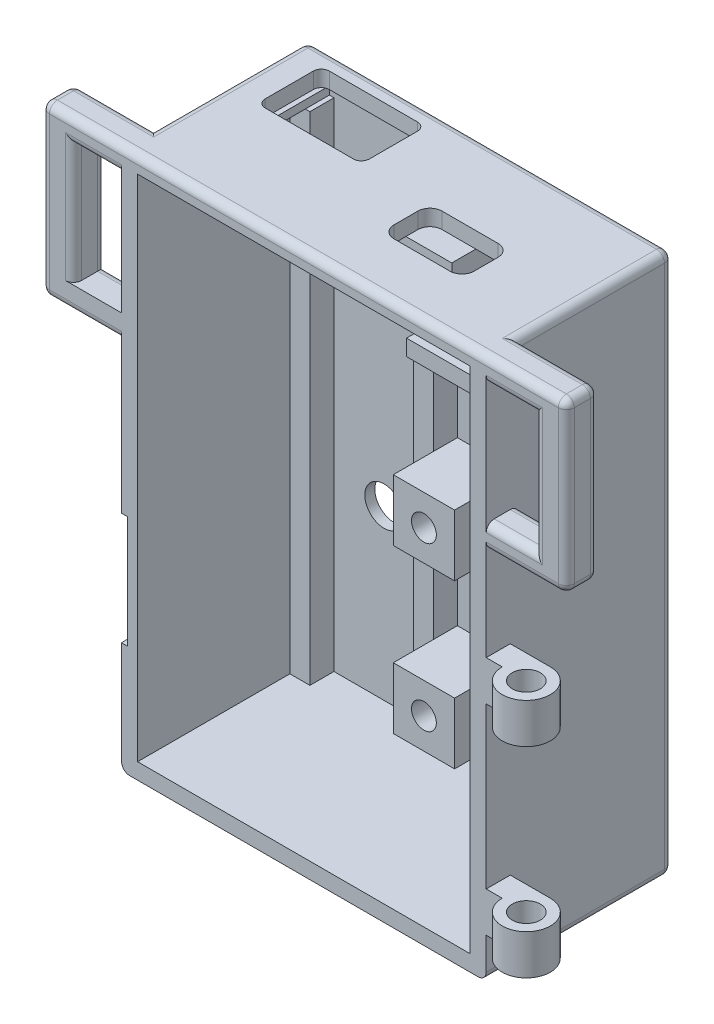
from build123d import *

# Parameters (mm, degrees)
SKETCH1_W                 = 45.5
SKETCH1_H                 = 67.5
BOSS_EXTRUDE1_DEPTH       = 1.25
SKETCH21_W                = 1.925
SKETCH21_H                = 1
BOSS_EXTRUDE10_DEPTH      = 8
SKETCH7_W                 = 45.5
SKETCH7_H                 = 67.5
SKETCH7_W_2               = 41.5
SKETCH7_H_2               = 63.5
BOSS_EXTRUDE4_DEPTH       = 22
SKETCH18_W                = 13
SKETCH18_H                = 8
CUT_EXTRUDE10_DEPTH       = 2
BOSS_EXTRUDE20_DEPTH      = 4
SKETCH49_R                = 1.75
BOSS_EXTRUDE21_DEPTH      = 35
SKETCH50_W                = 13.462095761
SKETCH50_H                = 5
SKETCH50_W_2              = 20.764616991
SKETCH50_H_2              = 20
CUT_EXTRUDE12_DEPTH       = 12
FILLET7_R                 = 1
M4_CLEARANCE_HOLE1_D      = 4.8
SKETCH42_W                = 7.3
SKETCH42_H                = 7.3
SKETCH42_W_2              = 19.24
SKETCH42_H_2              = 2
SKETCH42_W_3              = 7.65
SKETCH42_H_3              = 7.65
BOSS_EXTRUDE19_DEPTH      = 8
F_3_0MM_DOWEL_HOLE1_D     = 3.1
F_3_0MM_DOWEL_HOLE1_DEPTH = 2.8
F_3_0MM_DOWEL_HOLE1_TIP   = 0.931333959
SKETCH52_W                = 10
SKETCH52_H                = 6
CUT_EXTRUDE13_DEPTH       = 12
FILLET11_R                = 1.5
FILLET13_R                = 1
FILLET15_R                = 1
FILLET14_R                = 1
SKETCH53_R                = 7
CUT_EXTRUDE14_DEPTH       = 0.75
SKETCH54_W                = 2.5
SKETCH54_H                = 62
BOSS_EXTRUDE22_DEPTH      = 3


with BuildPart() as part:
    # Sketch1 → Boss-Extrude1 (new body)
    with BuildSketch(Plane.XY):
        Rectangle(SKETCH1_W, SKETCH1_H)
    extrude(amount=BOSS_EXTRUDE1_DEPTH)

    # Sketch21 → Boss-Extrude10 (add)
    with BuildSketch(Plane.XY.offset(1.25)):
        with Locations((-19.7875, 30.75)):
            Rectangle(SKETCH21_W, SKETCH21_H)
        with Locations((-3.8125, 30.75)):
            Rectangle(SKETCH21_W, SKETCH21_H)
    extrude(amount=BOSS_EXTRUDE10_DEPTH)

    # Sketch7 → Boss-Extrude4 (add)
    with BuildSketch(Plane.XY.offset(1.25)):
        Rectangle(SKETCH7_W, SKETCH7_H)
        Rectangle(SKETCH7_W_2, SKETCH7_H_2, mode=Mode.SUBTRACT)
    extrude(amount=BOSS_EXTRUDE4_DEPTH)

    # Sketch18 → Cut-Extrude10 (cut)
    with BuildSketch(Plane(origin=(0, 33.75, 0), x_dir=(1, 0, 0), z_dir=(0, 1, 0))):
        with Locations((-12.425, -6.15)):
            Rectangle(SKETCH18_W, SKETCH18_H)
    extrude(amount=-CUT_EXTRUDE10_DEPTH, mode=Mode.SUBTRACT)

    # Sketch48 → Boss-Extrude20 (add)
    with BuildSketch(Plane.XY.offset(23.25)):
        Polygon((22.75, 33.75), (32.75, 33.75), (32.75, 12.75), (22.75, 12.75), (22.75, 15.75), (28.75, 15.75), (28.75, 30.75), (22.75, 30.75), align=None)
        Polygon((-22.75, 30.75), (-28.75, 30.75), (-28.75, 15.75), (-22.75, 15.75), (-22.75, 12.75), (-32.75, 12.75), (-32.75, 33.75), (-22.75, 33.75), align=None)
    extrude(amount=-BOSS_EXTRUDE20_DEPTH)

    # Sketch49 → Boss-Extrude21 (add)
    with BuildSketch(Plane.XZ.offset(33.75)):
        with BuildLine():
            Line((27.75, 20.25), (22.75, 20.25))
            Line((22.75, 20.25), (22.75, 23.25))
            Line((22.75, 23.25), (24.75, 23.25))
            ThreePointArc((24.75, 23.25), (29.871320344, 25.371320344), (27.75, 20.25))
        make_face()
        with Locations(Location((27.75, 23.25, 0), (0, 0, 270))):
            Circle(SKETCH49_R, mode=Mode.SUBTRACT)
    extrude(amount=-BOSS_EXTRUDE21_DEPTH)

    # Sketch50 → Cut-Extrude12 (cut)
    with BuildSketch(Plane(origin=(22.75, 0, 0), x_dir=(0, 0, -1), z_dir=(1, 0, 0))):
        with Locations((-22.765361812, -31.25)):
            Rectangle(SKETCH50_W, SKETCH50_H)
        with Locations((-19.114101197, -13.75)):
            Rectangle(SKETCH50_W_2, SKETCH50_H_2)
    extrude(amount=CUT_EXTRUDE12_DEPTH, mode=Mode.SUBTRACT)

    # Fillet7
    fillet7_edges = [part.edges().sort_by_distance(p)[0] for p in [
        (-18.925, 32.75, 2.15),
        (-18.925, 32.75, 10.15),
        (-5.925, 32.75, 10.15),
        (-5.925, 32.75, 2.15),
    ]]
    fillet(fillet7_edges, radius=FILLET7_R)

    # M4 Clearance Hole1 (through all)
    with Locations(Plane.XY.offset(1.25)):
        with Locations((-12, 24.25), (8, 24.25), (8, -10.75), (-12, -10.75)):
            Hole(M4_CLEARANCE_HOLE1_D / 2)

    # Sketch42 → Boss-Extrude19 (add)
    with BuildSketch(Plane.XY.offset(1.25)):
        with Locations((0.8, 24.1)):
            Rectangle(SKETCH42_W, SKETCH42_H)
        with Locations((16.04, 24.1)):
            Rectangle(SKETCH42_W, SKETCH42_H)
        with Locations((8.42, 15.806169598)):
            Rectangle(SKETCH42_W_2, SKETCH42_H_2)
        with Locations((0.975, -22.925)):
            Rectangle(SKETCH42_W_3, SKETCH42_H_3)
        with Locations((13.675, -22.925)):
            Rectangle(SKETCH42_W_3, SKETCH42_H_3)
        with Locations((13.675, -2.605)):
            Rectangle(SKETCH42_W_3, SKETCH42_H_3)
        with Locations((0.975, -2.605)):
            Rectangle(SKETCH42_W_3, SKETCH42_H_3)
    extrude(amount=BOSS_EXTRUDE19_DEPTH)

    # Ø3.0mm Dowel Hole1
    with Locations(Plane.XY.offset(9.25)):
        with Locations((0.8, 24.1), (16.04, 24.1), (13.675, -2.605), (0.975, -2.605), (0.975, -22.925), (13.675, -22.925)):
            Hole(F_3_0MM_DOWEL_HOLE1_D / 2, depth=F_3_0MM_DOWEL_HOLE1_DEPTH)
            with Locations((0, 0, -(F_3_0MM_DOWEL_HOLE1_DEPTH + F_3_0MM_DOWEL_HOLE1_TIP / 2))):  # 118° drill point
                Cone(0, F_3_0MM_DOWEL_HOLE1_D / 2, F_3_0MM_DOWEL_HOLE1_TIP, mode=Mode.SUBTRACT)

    # Sketch52 → Cut-Extrude13 (cut)
    with BuildSketch(Plane(origin=(0, 31.75, 0), x_dir=(-1, 0, 0), z_dir=(0, -1, 0))):
        with Locations((-7.73, -13.25)):
            Rectangle(SKETCH52_W, SKETCH52_H)
    extrude(amount=-CUT_EXTRUDE13_DEPTH, mode=Mode.SUBTRACT)

    # Fillet11
    fillet11_edges = [part.edges().sort_by_distance(p)[0] for p in [
        (2.73, 32.75, 10.25),
        (2.73, 32.75, 16.25),
        (12.73, 32.75, 16.25),
        (12.73, 32.75, 10.25),
    ]]
    fillet(fillet11_edges, radius=FILLET11_R)

    # Fillet13
    fillet13_edges = [part.edges().sort_by_distance(p)[0] for p in [
        (22.75, -33.75, 11.625),
        (0, 33.75, 0),
        (22.75, 0, 0),
        (0, -33.75, 0),
        (-22.75, 0, 0),
        (-22.75, -33.75, 11.625),
        (-22.75, 33.75, 9.625),
        (22.75, 33.75, 9.625),
    ]]
    fillet(fillet13_edges, radius=FILLET13_R)

    # Fillet15
    fillet15_edges = [part.edges().sort_by_distance(p)[0] for p in [
        (25.75, 30.75, 23.25),
        (28.75, 23.25, 23.25),
        (32.75, 23.25, 23.25),
        (25.75, 15.75, 23.25),
        (27.75, 12.75, 23.25),
        (32.75, 12.75, 21.25),
        (32.75, 33.75, 21.25),
        (27.25, 33.75, 19.25),
        (25.75, 30.75, 19.25),
        (28.75, 23.25, 19.25),
        (32.75, 23.25, 19.25),
        (27.75, 12.75, 19.25),
        (25.75, 15.75, 19.25),
        (0, 33.75, 23.25),
    ]]
    fillet(fillet15_edges, radius=FILLET15_R)

    # Fillet14
    fillet14_edges = [part.edges().sort_by_distance(p)[0] for p in [
        (-25.75, 30.75, 19.25),
        (-28.75, 23.25, 19.25),
        (-25.75, 15.75, 19.25),
        (-27.75, 12.75, 19.25),
        (-32.75, 23.25, 19.25),
        (-32.75, 12.75, 21.25),
        (-27.25, 33.75, 19.25),
        (-32.75, 33.75, 20.75),
        (-27.75, 12.75, 23.25),
        (-28.75, 23.25, 23.25),
        (-25.75, 30.75, 23.25),
        (-32.75, 22.75, 23.25),
        (-32.75, 33.457106781, 22.957106781),
    ]]
    fillet(fillet14_edges, radius=FILLET14_R)

    # Sketch53 → Cut-Extrude14 (cut)
    with BuildSketch(Plane.ZY.offset(22.75)):
        with Locations((23.25, -12.898378645)):
            Circle(SKETCH53_R)
    extrude(amount=-CUT_EXTRUDE14_DEPTH, mode=Mode.SUBTRACT)

    # Sketch54 → Boss-Extrude22 (add)
    with BuildSketch(Plane.XY.offset(1.25)):
        with Locations((-19.5, -0.75)):
            Rectangle(SKETCH54_W, SKETCH54_H)
        with Locations((-4.1, -0.75)):
            Rectangle(SKETCH54_W, SKETCH54_H)
    extrude(amount=BOSS_EXTRUDE22_DEPTH)


solid = part.part
